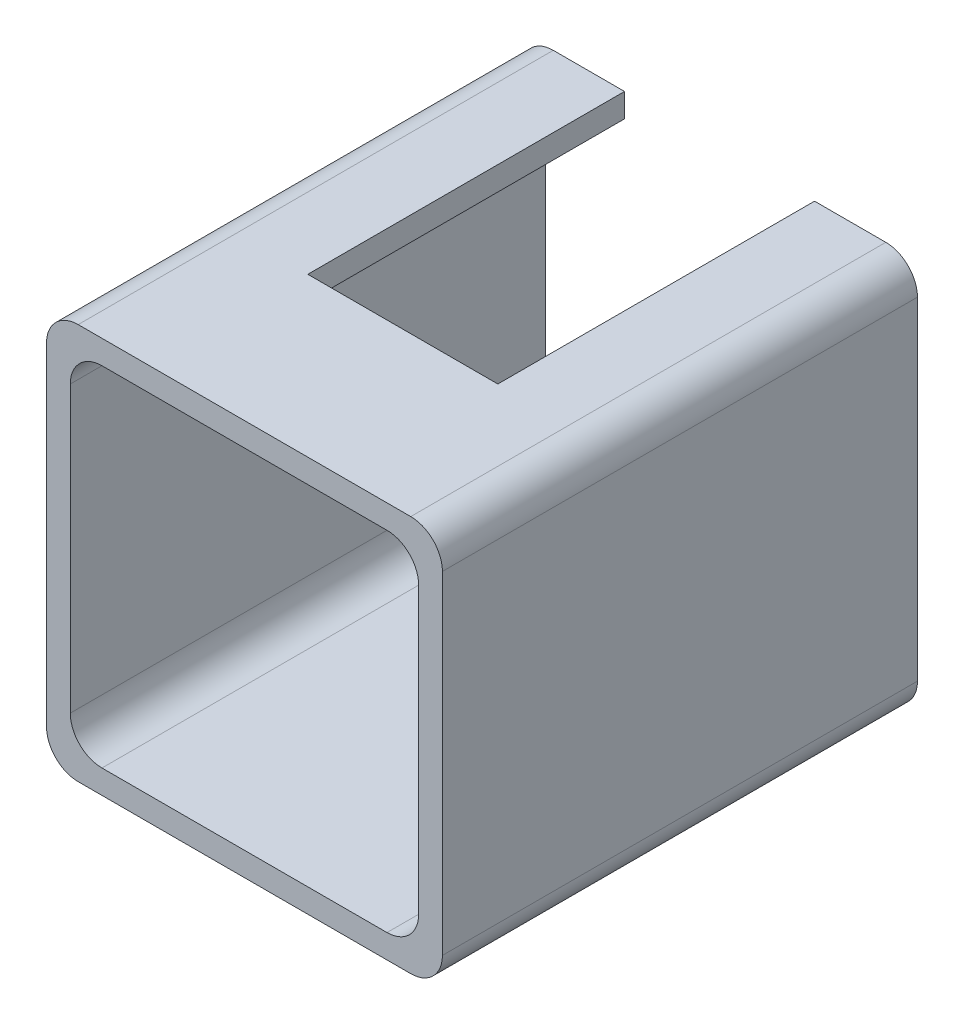
from build123d import *

# Parameters (mm, degrees)
EXTRUDE_1_DEPTH     = 30
CUT_EXTRUDE_1_REACH = 43.003
SKETCH_2_W          = 12
SKETCH_2_H          = 20


with BuildPart() as part:
    # 草图1 → 凸台-拉伸1 (new body)
    with BuildSketch(Plane.XY):
        with BuildLine():
            Line((12.5, 10.5), (12.5, -10.5))
            ThreePointArc((12.5, -10.5), (11.914213562, -11.914213562), (10.5, -12.5))
            Line((10.5, -12.5), (-10.5, -12.5))
            ThreePointArc((-10.5, -12.5), (-11.914213562, -11.914213562), (-12.5, -10.5))
            Line((-12.5, -10.5), (-12.5, 10.5))
            ThreePointArc((-12.5, 10.5), (-11.914213562, 11.914213562), (-10.5, 12.5))
            Line((-10.5, 12.5), (10.5, 12.5))
            ThreePointArc((10.5, 12.5), (11.914213562, 11.914213562), (12.5, 10.5))
        make_face()
        with BuildLine():
            Line((-9, 11), (9, 11))
            ThreePointArc((9, 11), (10.414213562, 10.414213562), (11, 9))
            Line((11, 9), (11, -9))
            ThreePointArc((11, -9), (10.414213562, -10.414213562), (9, -11))
            Line((9, -11), (-9, -11))
            ThreePointArc((-9, -11), (-10.414213562, -10.414213562), (-11, -9))
            Line((-11, -9), (-11, 9))
            ThreePointArc((-11, 9), (-10.414213562, 10.414213562), (-9, 11))
        make_face(mode=Mode.SUBTRACT)
    extrude(amount=EXTRUDE_1_DEPTH)

    # 草图2 → 切除-拉伸1 (cut, up to next)
    with BuildSketch(Plane(origin=(0, 12.5, 0), x_dir=(1, 0, 0), z_dir=(0, 1, 0)), mode=Mode.PRIVATE) as cut_extrude_1_sk1:
        with Locations((0, -10)):
            Rectangle(SKETCH_2_W, SKETCH_2_H)
    cut_extrude_1_tool1 = extrude(cut_extrude_1_sk1.sketch, amount=-CUT_EXTRUDE_1_REACH, mode=Mode.PRIVATE) & part.part
    add(cut_extrude_1_tool1.solids().sort_by_distance((0, 12.5, 10))[0], mode=Mode.SUBTRACT)


solid = part.part
